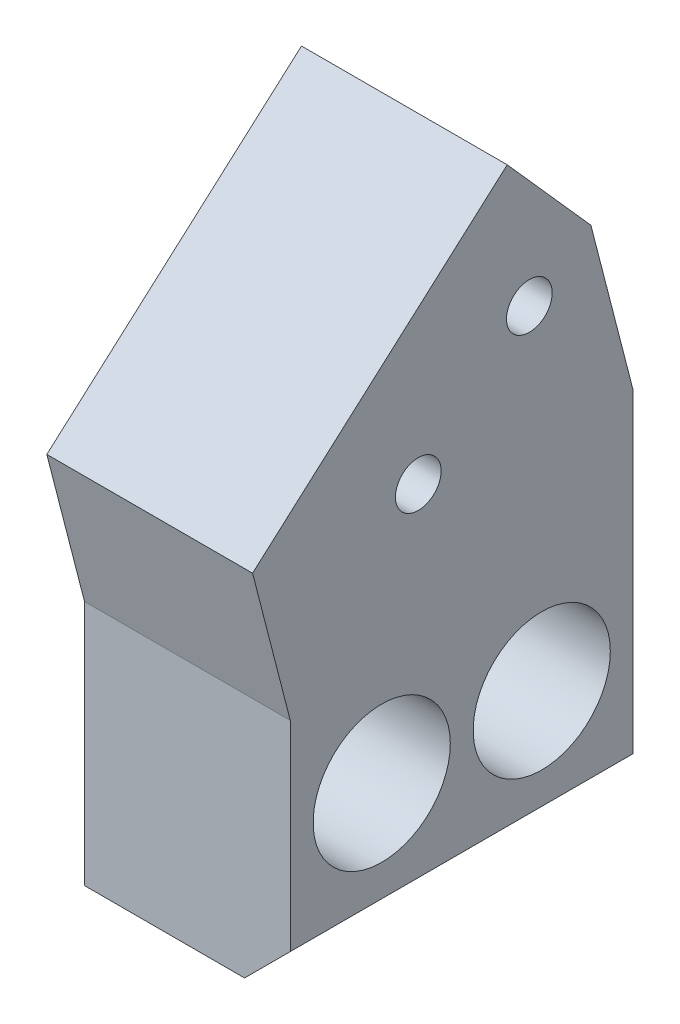
from build123d import *

# Parameters (mm, degrees)
SKETCH1_R           = 1
BOSS_EXTRUDE1_DEPTH = 9
CHAMFER1_SIZE       = 2
SKETCH5_R           = 1.411016717
CUT_EXTRUDE4_DEPTH  = 32.657609573
CUT_EXTRUDE5_DEPTH  = 32.657609573
SKETCH7_R           = 3
CUT_EXTRUDE6_DEPTH  = 5


with BuildPart() as part:
    # Sketch1 → Boss-Extrude1 (new body)
    with BuildSketch(Plane(origin=(0, 0, 0), x_dir=(0, 0, -1), z_dir=(1, 0, 0))):
        Polygon((-7.5, 0), (7.5, 0), (7.5, 15.76), (4.103828097, 28.939458123), (-9.149426619, 17.160897736), (-7.5, 10.76), align=None)
        with Locations((2.957491833, 21.231429279)):
            Circle(SKETCH1_R, mode=Mode.SUBTRACT)
        with Locations((-1.901052893, 16.913496539)):
            Circle(SKETCH1_R, mode=Mode.SUBTRACT)
    extrude(amount=BOSS_EXTRUDE1_DEPTH)

    # Chamfer1
    chamfer1_edges = [part.edges().sort_by_distance(p)[0] for p in [
        (4.5, 0, -7.5),
        (9, 0, 0),
    ]]
    chamfer(chamfer1_edges, length=CHAMFER1_SIZE)

    # Sketch5 → Cut-Extrude4 (cut, through all)
    with BuildSketch(Plane(origin=(9, 0, 0), x_dir=(0, 0, -1), z_dir=(1, 0, 0))):
        with Locations((3.500000028, 6.380001803)):
            Circle(SKETCH5_R)
        with Locations((-3.5, 6.380001848)):
            Circle(SKETCH5_R)
    extrude(amount=-CUT_EXTRUDE4_DEPTH, mode=Mode.SUBTRACT)

    # Sketch6 → Cut-Extrude5 (cut, through all)
    with BuildSketch(Plane(origin=(9, 0, 0), x_dir=(0, 0, -1), z_dir=(1, 0, 0))):
        Polygon((1.990530631, 27.061308011), (5.648400148, 22.945467464), (4.103828097, 28.939458123), align=None)
    extrude(amount=-CUT_EXTRUDE5_DEPTH, mode=Mode.SUBTRACT)

    # Sketch7 → Cut-Extrude6 (cut)
    with BuildSketch(Plane(origin=(9, 0, 0), x_dir=(0, 0, -1), z_dir=(1, 0, 0))):
        with Locations((3.500000028, 6.380001803)):
            Circle(SKETCH7_R)
        with Locations((-3.5, 6.380001848)):
            Circle(SKETCH7_R)
    extrude(amount=-CUT_EXTRUDE6_DEPTH, mode=Mode.SUBTRACT)


solid = part.part
